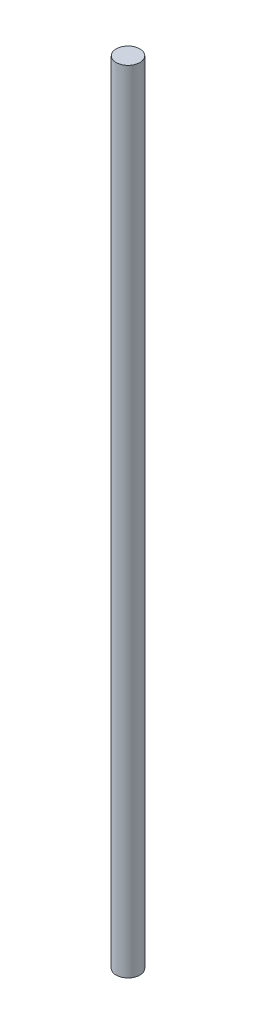
from build123d import *

# Parameters (mm, degrees)
SKETCH_1_R      = 3
EXTRUDE_1_DEPTH = 200


with BuildPart() as part:
    # 草图1 → 凸台-拉伸1 (new body)
    with BuildSketch(Plane(origin=(0, 0, 0), x_dir=(1, 0, 0), z_dir=(0, 1, 0))):
        with Locations(Location((0, 0, 0), (0, 0, 270))):
            Circle(SKETCH_1_R)
    extrude(amount=EXTRUDE_1_DEPTH)


solid = part.part
